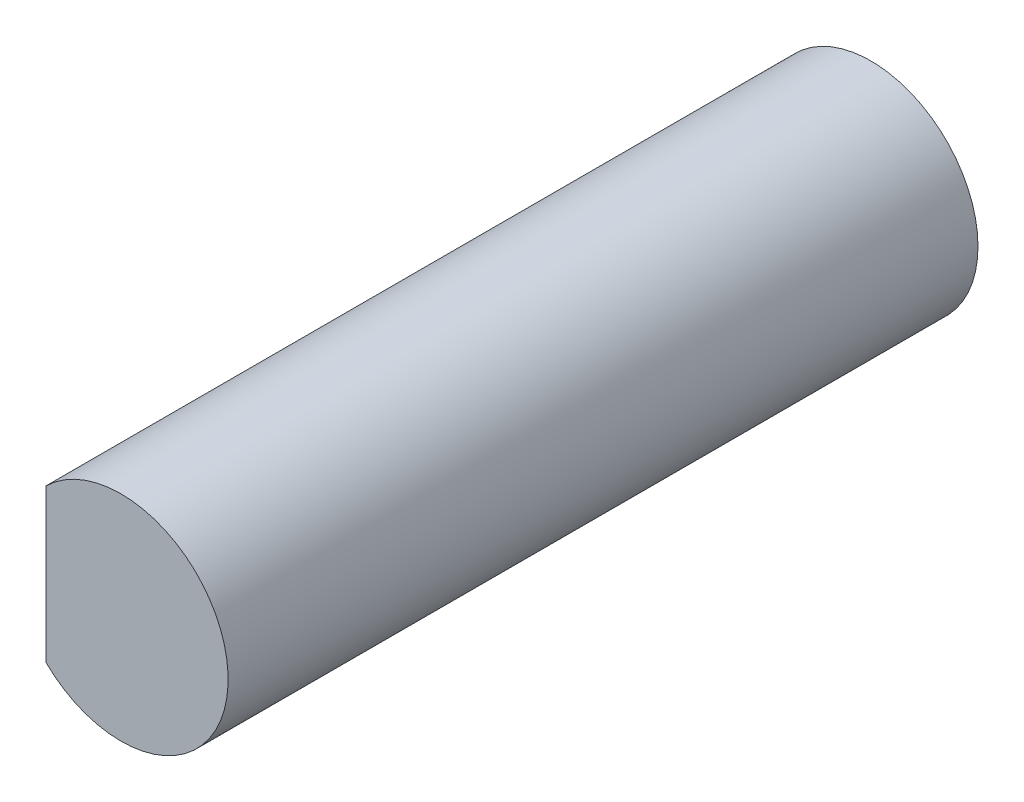
from build123d import *

# Parameters (mm, degrees)
SKETCH_1_R          = 5
EXTRUDE_1_DEPTH     = 25
SKETCH_2_OUTSIDE_W  = 17.744
SKETCH_2_OUTSIDE_H  = 17.744
CUT_EXTRUDE_1_DEPTH = 15
EXTRUDE_START       = 10
SKETCH_3_R          = 5
EXTRUDE_2_DEPTH     = 10


with BuildPart() as part:
    # 스케치1 → 보스-돌출1 (new body)
    with BuildSketch(Plane.XY):
        Circle(SKETCH_1_R)
    extrude(amount=EXTRUDE_1_DEPTH)

    # 스케치2 outside → 컷-돌출1 (cut)
    with BuildSketch(Plane.XY.offset(25)):
        Rectangle(SKETCH_2_OUTSIDE_W, SKETCH_2_OUTSIDE_H)
        with BuildLine():
            Line((-3.5, 3.570714214), (-3.5, -3.570714214))
            ThreePointArc((-3.5, -3.570714214), (5, 0), (-3.5, 3.570714214))
        make_face(mode=Mode.SUBTRACT)
    extrude(amount=-CUT_EXTRUDE_1_DEPTH, mode=Mode.SUBTRACT)

    # 스케치3 → 보스-돌출2 (add)
    with BuildSketch(Plane(origin=(0, 0, 0), x_dir=(-1, 0, 0), z_dir=(0, 0, -1)).offset(EXTRUDE_START)):
        Circle(SKETCH_3_R)
    extrude(amount=-EXTRUDE_2_DEPTH)


solid = part.part
